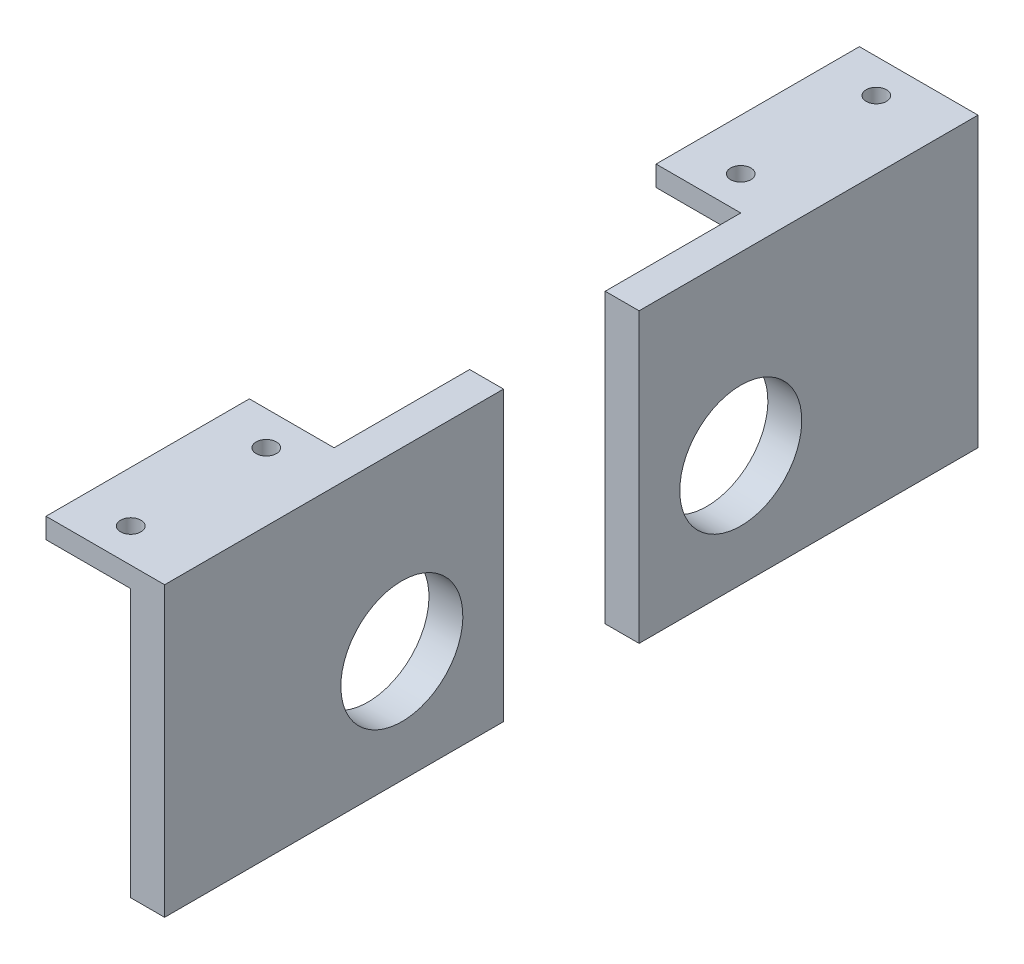
from build123d import *

# Parameters (mm, degrees)
EXTRUDE_1_DEPTH     = 5
SKETCH_2_R          = 9
CUT_EXTRUDE_1_DEPTH = 5
EXTRUDE_2_DEPTH     = 3
SKETCH_6_R          = 1.5
CUT_EXTRUDE_2_DEPTH = 3


with BuildPart() as part:
    # 草图1 → 凸台-拉伸1 (new body)
    with BuildSketch(Plane(origin=(0, 0, 0), x_dir=(0, 0, -1), z_dir=(1, 0, 0))):
        Polygon((-15, -28.5), (-15, 11), (15, 11), (35, 11), (35, -28.5), (15, -28.5), align=None)
    extrude(amount=EXTRUDE_1_DEPTH)

    # 草图2 → 切除-拉伸1 (cut)
    with BuildSketch(Plane(origin=(5, 0, 0), x_dir=(0, 0, -1), z_dir=(1, 0, 0))):
        with Locations(Location((20, -12, 0), (0, 0, 90))):
            Circle(SKETCH_2_R)
    extrude(amount=-CUT_EXTRUDE_1_DEPTH, mode=Mode.SUBTRACT)

    # 草图3 → 凸台-拉伸2 (add)
    with BuildSketch(Plane(origin=(0, 11, 0), x_dir=(1, 0, 0), z_dir=(0, 1, 0))):
        Polygon((5, 15), (5, 35), (0, 35), (0, 15), (-12.5, 15), (-12.5, -15), (5, -15), align=None)
    extrude(amount=EXTRUDE_2_DEPTH)

    # 草图6 → 切除-拉伸2 (cut)
    with BuildSketch(Plane(origin=(0, 14, 0), x_dir=(1, 0, 0), z_dir=(0, 1, 0))):
        with Locations(Location((-5, 10, 0), (0, 0, 270))):
            Circle(SKETCH_6_R)
        with Locations(Location((-5, -10, 0), (0, 0, 270))):
            Circle(SKETCH_6_R)
    extrude(amount=-CUT_EXTRUDE_2_DEPTH, mode=Mode.SUBTRACT)


with BuildPart() as body_2:
    # 镜向4: mirrored copy
    add(part.part.mirror(Plane(origin=(0, 0, -45), x_dir=(1, 0, 0), z_dir=(0, 0, -1))))


solid = Compound([part.part, body_2.part])
